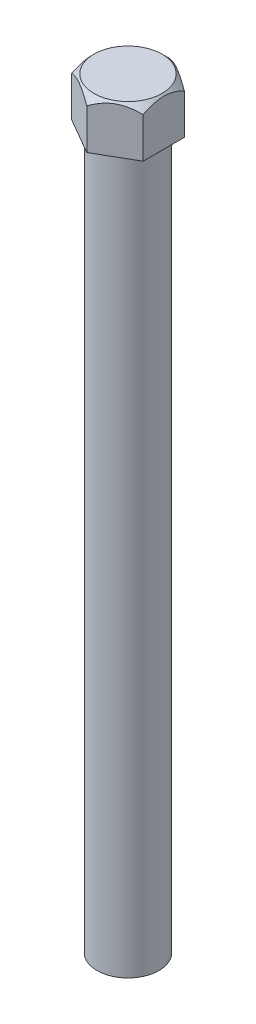
from build123d import *

# Parameters (mm, degrees)
SKETCH2_R           = 3.302
BOSS_EXTRUDE1_DEPTH = 40.64
BOSS_EXTRUDE2_DEPTH = 5.08


with BuildPart() as part:
    # Sketch2 → Boss-Extrude1 (new, symmetric)
    with BuildSketch(Plane(origin=(0, 0, 0), x_dir=(1, 0, 0), z_dir=(0, 1, 0))):
        with Locations(Location((0, 0, 0), (0, 0, 270))):
            Circle(SKETCH2_R)
    extrude(amount=BOSS_EXTRUDE1_DEPTH, both=True)

    # Sketch3 → Boss-Extrude2 (add)
    with BuildSketch(Plane(origin=(0, 40.64, 0), x_dir=(1, 0, 0), z_dir=(0, 1, 0))):
        Polygon((3.81, 2.199704526), (0, 4.399409051), (-3.81, 2.199704526), (-3.81, -2.199704526), (0, -4.399409051), (3.81, -2.199704526), align=None)
    extrude(amount=-BOSS_EXTRUDE2_DEPTH)

    # Sketch6 → Cut-Revolve1 (revolve, cut)
    with BuildSketch(Plane(origin=(0, 0, 0), x_dir=(0.8660254037844385, 0, -0.5000000000000004), z_dir=(0.5000000000000003, 0, 0.8660254037844384)), mode=Mode.PRIVATE) as cut_revolve1_sk:
        Polygon((-3.637409051, 40.64), (-4.399409051, 40.64), (-4.399409051, 39.878), align=None)
    revolve(cut_revolve1_sk.sketch.rotate(Axis((0, 0, 0), (0, 1, 0)), 240), axis=Axis((0, 0, 0), (0, 1, 0)), mode=Mode.SUBTRACT)


solid = part.part
